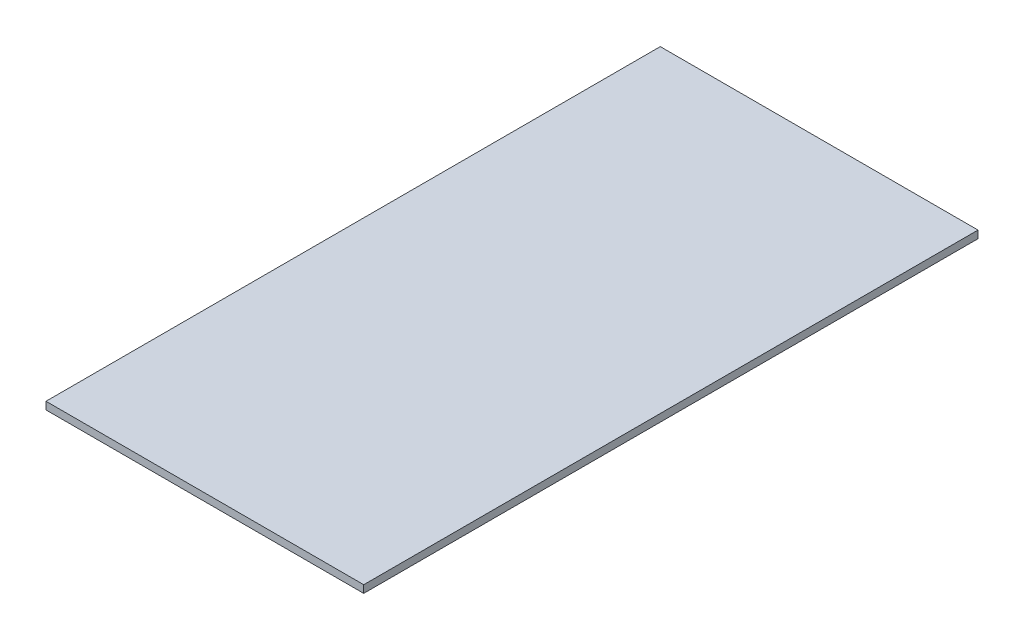
from build123d import *

# Parameters (mm, degrees)
SKETCH1_W           = 300
SKETCH1_H           = 580
BOSS_EXTRUDE1_DEPTH = 7.112


with BuildPart() as part:
    # Sketch1 → Boss-Extrude1 (new body)
    with BuildSketch(Plane(origin=(0, 0, 0), x_dir=(1, 0, 0), z_dir=(0, 1, 0))):
        with Locations((0, 290)):
            Rectangle(SKETCH1_W, SKETCH1_H)
    extrude(amount=BOSS_EXTRUDE1_DEPTH)


solid = part.part
